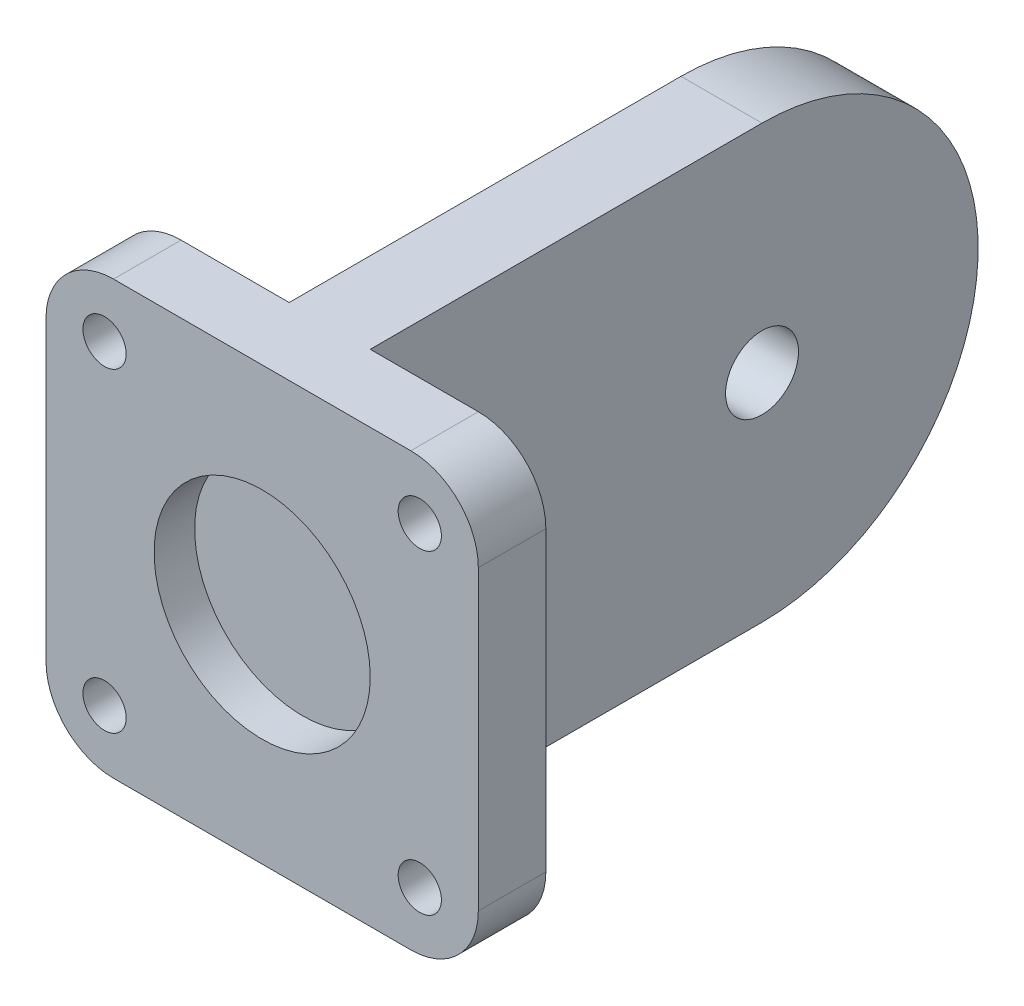
from build123d import *

# Parameters (mm, degrees)
SKETCH1_R           = 1.6
BOSS_EXTRUDE1_DEPTH = 5
SKETCH2_W           = 6
SKETCH2_H           = 50
BOSS_EXTRUDE2_DEPTH = 32
SKETCH3_R           = 2.7
CUT_EXTRUDE1_DEPTH  = 7
SKETCH4_R           = 8
CUT_EXTRUDE2_DEPTH  = 3
CUT_EXTRUDE3_DEPTH  = 68.692277038


with BuildPart() as part:
    # Sketch1 → Boss-Extrude1 (new body)
    with BuildSketch(Plane.XY):
        with BuildLine():
            Line((-11, -9.487882213), (11, -9.487882213))
            ThreePointArc((11, -9.487882213), (14.535533906, -10.952348307), (16, -14.487882213))
            Line((16, -14.487882213), (16, -36.487882213))
            ThreePointArc((16, -36.487882213), (14.535533906, -40.023416119), (11, -41.487882213))
            Line((11, -41.487882213), (-11, -41.487882213))
            ThreePointArc((-11, -41.487882213), (-14.535533906, -40.023416119), (-16, -36.487882213))
            Line((-16, -36.487882213), (-16, -14.487882213))
            ThreePointArc((-16, -14.487882213), (-14.535533906, -10.952348307), (-11, -9.487882213))
        make_face()
        with Locations((11.66726189, -13.820620324)):
            Circle(SKETCH1_R, mode=Mode.SUBTRACT)
        with Locations((11.66726189, -37.155144103)):
            Circle(SKETCH1_R, mode=Mode.SUBTRACT)
        with Locations((-11.66726189, -37.155144103)):
            Circle(SKETCH1_R, mode=Mode.SUBTRACT)
        with Locations((-11.66726189, -13.820620324)):
            Circle(SKETCH1_R, mode=Mode.SUBTRACT)
    extrude(amount=-BOSS_EXTRUDE1_DEPTH)

    # Sketch2 → Boss-Extrude2 (add)
    with BuildSketch(Plane(origin=(0, -9.487882213, 0), x_dir=(1, 0, 0), z_dir=(0, 1, 0))):
        with Locations((0, 25)):
            Rectangle(SKETCH2_W, SKETCH2_H)
    extrude(amount=-BOSS_EXTRUDE2_DEPTH)

    # Sketch3 → Cut-Extrude1 (cut)
    with BuildSketch(Plane.ZY.offset(3)):
        with Locations((-34, -25.487882213)):
            Circle(SKETCH3_R)
    extrude(amount=-CUT_EXTRUDE1_DEPTH, mode=Mode.SUBTRACT)

    # Sketch4 → Cut-Extrude2 (cut)
    with BuildSketch(Plane.XY):
        with Locations((0, -25.487882213)):
            Circle(SKETCH4_R)
    extrude(amount=-CUT_EXTRUDE2_DEPTH, mode=Mode.SUBTRACT)

    # Sketch7 → Cut-Extrude3 (cut, through all)
    with BuildSketch(Plane.ZY.offset(3)):
        with BuildLine():
            Line((-34, -9.487882213), (-52.373766184, -9.487882213))
            Line((-52.373766184, -9.487882213), (-52.373766184, -41.487882213))
            Line((-52.373766184, -41.487882213), (-34, -41.487882213))
            ThreePointArc((-34, -41.487882213), (-50, -25.487882213), (-34, -9.487882213))
        make_face()
    extrude(amount=-CUT_EXTRUDE3_DEPTH, mode=Mode.SUBTRACT)


solid = part.part
